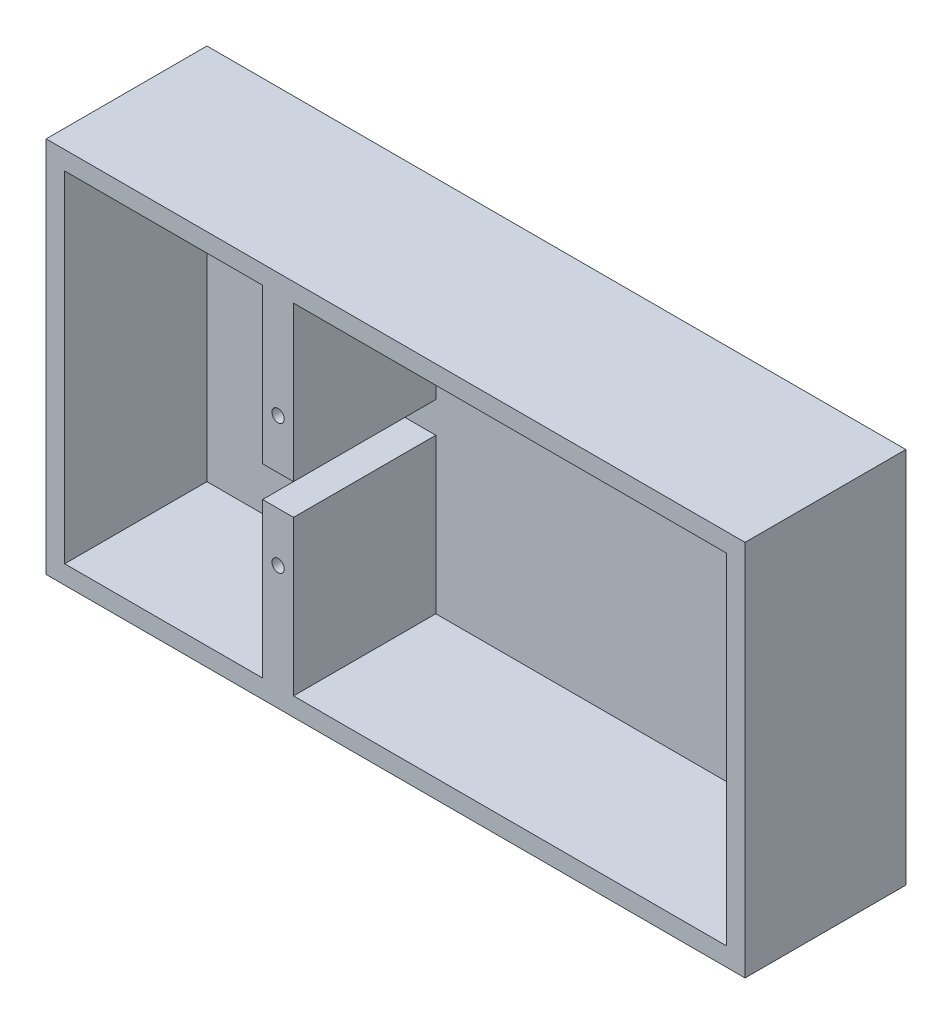
from build123d import *

# Parameters (mm, degrees)
SKETCH1_W           = 113
SKETCH1_H           = 61
SKETCH1_W_2         = 70
SKETCH1_H_2         = 55
SKETCH1_W_3         = 32
BOSS_EXTRUDE1_DEPTH = 26
SKETCH2_W           = 70
SKETCH2_H           = 55
SKETCH2_W_2         = 32
BOSS_EXTRUDE2_DEPTH = 3
SKETCH3_W           = 23
SKETCH3_H           = 5
CUT_EXTRUDE1_DEPTH  = 5
SKETCH5_R           = 4
CUT_EXTRUDE3_DEPTH  = 10
SKETCH6_R           = 1
CUT_EXTRUDE4_DEPTH  = 30


with BuildPart() as part:
    # Sketch1 → Boss-Extrude1 (new body)
    with BuildSketch(Plane.XY):
        with Locations((-56.5, 30.5)):
            Rectangle(SKETCH1_W, SKETCH1_H)
        with Locations((-38, 30.5)):
            Rectangle(SKETCH1_W_2, SKETCH1_H_2, mode=Mode.SUBTRACT)
        with Locations((-94, 30.5)):
            Rectangle(SKETCH1_W_3, SKETCH1_H_2, mode=Mode.SUBTRACT)
    extrude(amount=BOSS_EXTRUDE1_DEPTH)

    # Sketch2 → Boss-Extrude2 (add)
    with BuildSketch(Plane(origin=(0, 0, 0), x_dir=(-1, 0, 0), z_dir=(0, 0, -1))):
        with Locations((38, 30.5)):
            Rectangle(SKETCH2_W, SKETCH2_H)
        with Locations((94, 30.5)):
            Rectangle(SKETCH2_W_2, SKETCH2_H)
    extrude(amount=-BOSS_EXTRUDE2_DEPTH)

    # Sketch3 → Cut-Extrude1 (cut)
    with BuildSketch(Plane(origin=(-73, 0, 0), x_dir=(0, 0, -1), z_dir=(1, 0, 0))):
        with Locations((-14.5, 30.5)):
            Rectangle(SKETCH3_W, SKETCH3_H)
    extrude(amount=-CUT_EXTRUDE1_DEPTH, mode=Mode.SUBTRACT)

    # Sketch5 → Cut-Extrude3 (cut)
    with BuildSketch(Plane(origin=(0, 0, 0), x_dir=(-1, 0, 0), z_dir=(0, -1, 0))):
        with Locations(Location((12.5, -8, 0), (0, 0, 90))):
            Circle(SKETCH5_R)
    extrude(amount=-CUT_EXTRUDE3_DEPTH, mode=Mode.SUBTRACT)

    # Sketch6 → Cut-Extrude4 (cut)
    with BuildSketch(Plane.XY.offset(26)):
        with Locations((-75.5, 41)):
            Circle(SKETCH6_R)
        with Locations((-75.5, 20)):
            Circle(SKETCH6_R)
    extrude(amount=-CUT_EXTRUDE4_DEPTH, mode=Mode.SUBTRACT)


solid = part.part
